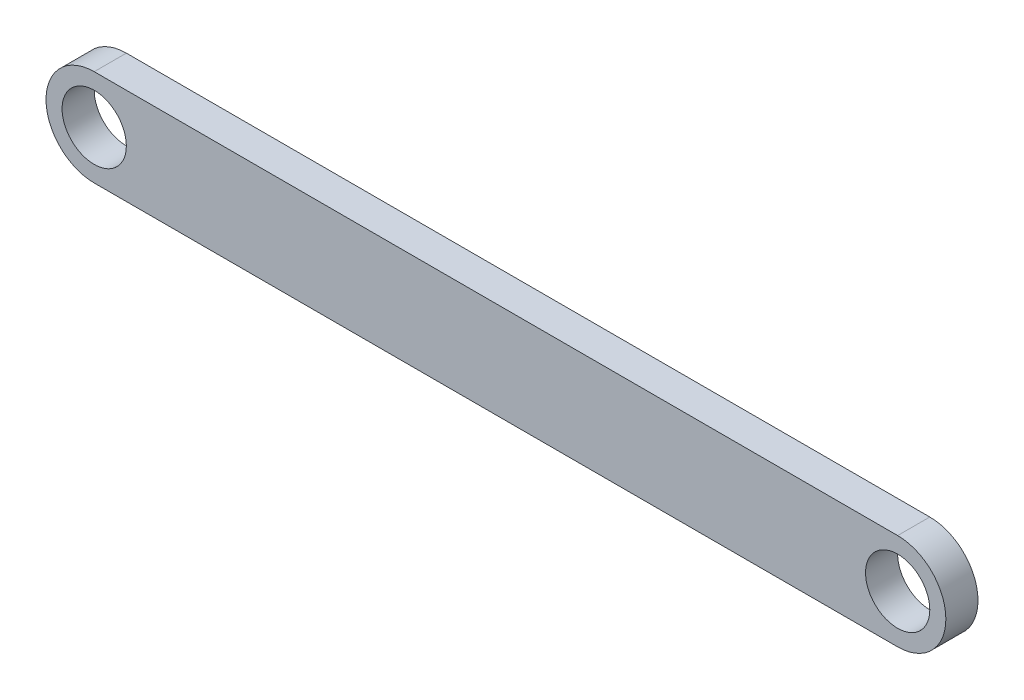
from build123d import *

# Parameters (mm, degrees)
SKETCH1_R           = 6.35
BOSS_EXTRUDE1_DEPTH = 6.35


with BuildPart() as part:
    # Sketch1 → Boss-Extrude1 (new body)
    with BuildSketch(Plane.XY):
        with BuildLine():
            Line((-75.85152439, 14.055182927), (82.89847561, 14.055182927))
            ThreePointArc((82.89847561, 14.055182927), (92.42347561, 4.530182927), (82.89847561, -4.994817073))
            Line((82.89847561, -4.994817073), (-75.85152439, -4.994817073))
            ThreePointArc((-75.85152439, -4.994817073), (-85.37652439, 4.530182927), (-75.85152439, 14.055182927))
        make_face()
        with Locations((-75.85152439, 4.530182927)):
            Circle(SKETCH1_R, mode=Mode.SUBTRACT)
        with Locations((82.89847561, 4.530182927)):
            Circle(SKETCH1_R, mode=Mode.SUBTRACT)
    extrude(amount=BOSS_EXTRUDE1_DEPTH)


solid = part.part
